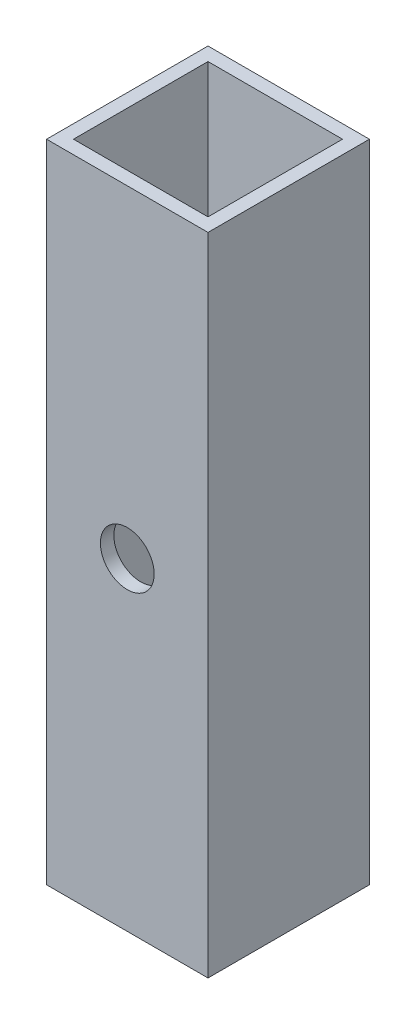
from build123d import *

# Parameters (mm, degrees)
SKETCH1_W                  = 38.1
SKETCH1_H                  = 38.1
SKETCH1_W_2                = 31.75
SKETCH1_H_2                = 31.75
BOSS_EXTRUDE1_DEPTH        = 152.4
F_1_2_0_5_DIAMETER_HOLE1_D = 12.7


with BuildPart() as part:
    # Sketch1 → Boss-Extrude1 (new body)
    with BuildSketch(Plane(origin=(0, 0, 0), x_dir=(1, 0, 0), z_dir=(0, 1, 0))):
        with Locations((19.05, 19.05)):
            Rectangle(SKETCH1_W, SKETCH1_H)
        with Locations((19.05, 19.05)):
            Rectangle(SKETCH1_W_2, SKETCH1_H_2, mode=Mode.SUBTRACT)
    extrude(amount=BOSS_EXTRUDE1_DEPTH)

    # 1/2 (0.5) Diameter Hole1 (through all)
    with Locations(Plane.XY):
        with Locations((19.05, 76.2)):
            Hole(F_1_2_0_5_DIAMETER_HOLE1_D / 2)


solid = part.part
